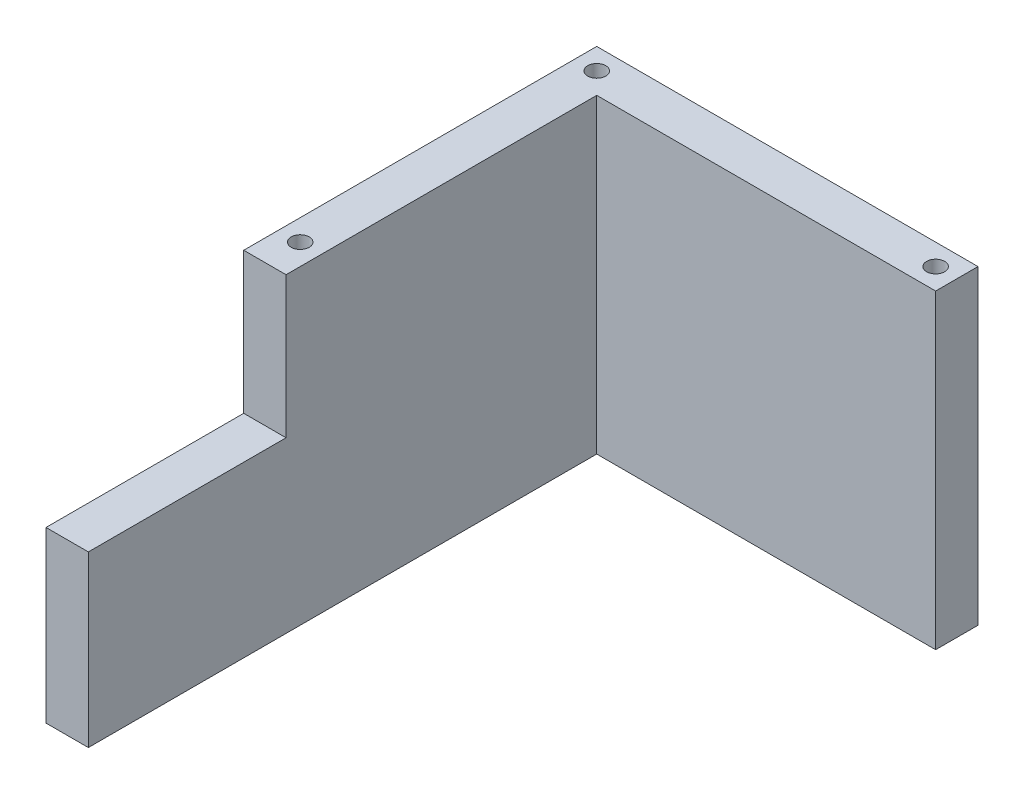
from build123d import *

# Parameters (mm, degrees)
BOSS_EXTRUDE1_DEPTH                            = 69.85
CBORE_FOR_4_SOCKET_HEAD_CAP_SCREW1_D           = 3.2639
CBORE_FOR_4_SOCKET_HEAD_CAP_SCREW1_DEPTH       = 9.525
CBORE_FOR_4_SOCKET_HEAD_CAP_SCREW1_CBORE_D     = 3.96875
CBORE_FOR_4_SOCKET_HEAD_CAP_SCREW1_CBORE_DEPTH = 4.7625
CBORE_FOR_4_SOCKET_HEAD_CAP_SCREW1_TIP         = 0.980574487
SKETCH4_R                                      = 2.032
CUT_EXTRUDE1_DEPTH                             = 4.7625
SKETCH5_R                                      = 1.63195
CUT_EXTRUDE2_DEPTH                             = 3.175
CUT_EXTRUDE3_REACH                             = 168.013
SKETCH6_W                                      = 44.45
SKETCH6_H                                      = 31.75


with BuildPart() as part:
    # Sketch1 → Boss-Extrude1 (new body)
    with BuildSketch(Plane(origin=(0, 0, 0), x_dir=(1, 0, 0), z_dir=(0, 1, 0))):
        Polygon((0, 0), (85.725, 0), (85.725, -9.525), (9.525, -9.525), (9.525, -123.825), (0, -123.825), align=None)
    extrude(amount=BOSS_EXTRUDE1_DEPTH)

    # CBORE for #4 Socket Head Cap Screw1
    with Locations(Plane(origin=(0, 0, 0), x_dir=(-1, 0, 0), z_dir=(0, -1, 0))):
        with Locations((-4.7625, -4.7625), (-4.7625, -39.6875), (-4.7625, -74.6125), (-39.6875, -4.7625), (-74.6125, -4.7625), (-4.7625, -109.5375)):
            CounterBoreHole(CBORE_FOR_4_SOCKET_HEAD_CAP_SCREW1_D / 2, CBORE_FOR_4_SOCKET_HEAD_CAP_SCREW1_CBORE_D / 2, CBORE_FOR_4_SOCKET_HEAD_CAP_SCREW1_CBORE_DEPTH, depth=CBORE_FOR_4_SOCKET_HEAD_CAP_SCREW1_DEPTH)
            with Locations((0, 0, -(CBORE_FOR_4_SOCKET_HEAD_CAP_SCREW1_DEPTH + CBORE_FOR_4_SOCKET_HEAD_CAP_SCREW1_TIP / 2))):  # 118° drill point
                Cone(0, CBORE_FOR_4_SOCKET_HEAD_CAP_SCREW1_D / 2, CBORE_FOR_4_SOCKET_HEAD_CAP_SCREW1_TIP, mode=Mode.SUBTRACT)

    # Sketch4 → Cut-Extrude1 (cut)
    with BuildSketch(Plane(origin=(0, 69.85, 0), x_dir=(1, 0, 0), z_dir=(0, 1, 0))):
        with Locations(Location((4.7625, -4.7625, 0), (0, 0, 270))):
            Circle(SKETCH4_R)
        with Locations(Location((80.9625, -4.7625, 0), (0, 0, 270))):
            Circle(SKETCH4_R)
        with Locations(Location((4.7625, -71.4375, 0), (0, 0, 270))):
            Circle(SKETCH4_R)
    extrude(amount=-CUT_EXTRUDE1_DEPTH, mode=Mode.SUBTRACT)

    # Sketch5 → Cut-Extrude2 (cut)
    with BuildSketch(Plane(origin=(0, 65.0875, 0), x_dir=(1, 0, 0), z_dir=(0, 1, 0))):
        with Locations(Location((4.7625, -4.7625, 0), (0, 0, 90))):
            Circle(SKETCH5_R)
        with Locations(Location((80.9625, -4.7625, 0), (0, 0, 270))):
            Circle(SKETCH5_R)
        with Locations(Location((4.7625, -71.4375, 0), (0, 0, 270))):
            Circle(SKETCH5_R)
    extrude(amount=-CUT_EXTRUDE2_DEPTH, mode=Mode.SUBTRACT)

    # Sketch6 → Cut-Extrude3 (cut, up to next)
    with BuildSketch(Plane.ZY, mode=Mode.PRIVATE) as cut_extrude3_sk1:
        with Locations((101.6, 53.975)):
            Rectangle(SKETCH6_W, SKETCH6_H)
    cut_extrude3_tool1 = extrude(cut_extrude3_sk1.sketch, amount=-CUT_EXTRUDE3_REACH, mode=Mode.PRIVATE) & part.part
    add(cut_extrude3_tool1.solids().sort_by_distance((0, 53.975, 101.6))[0], mode=Mode.SUBTRACT)


solid = part.part
